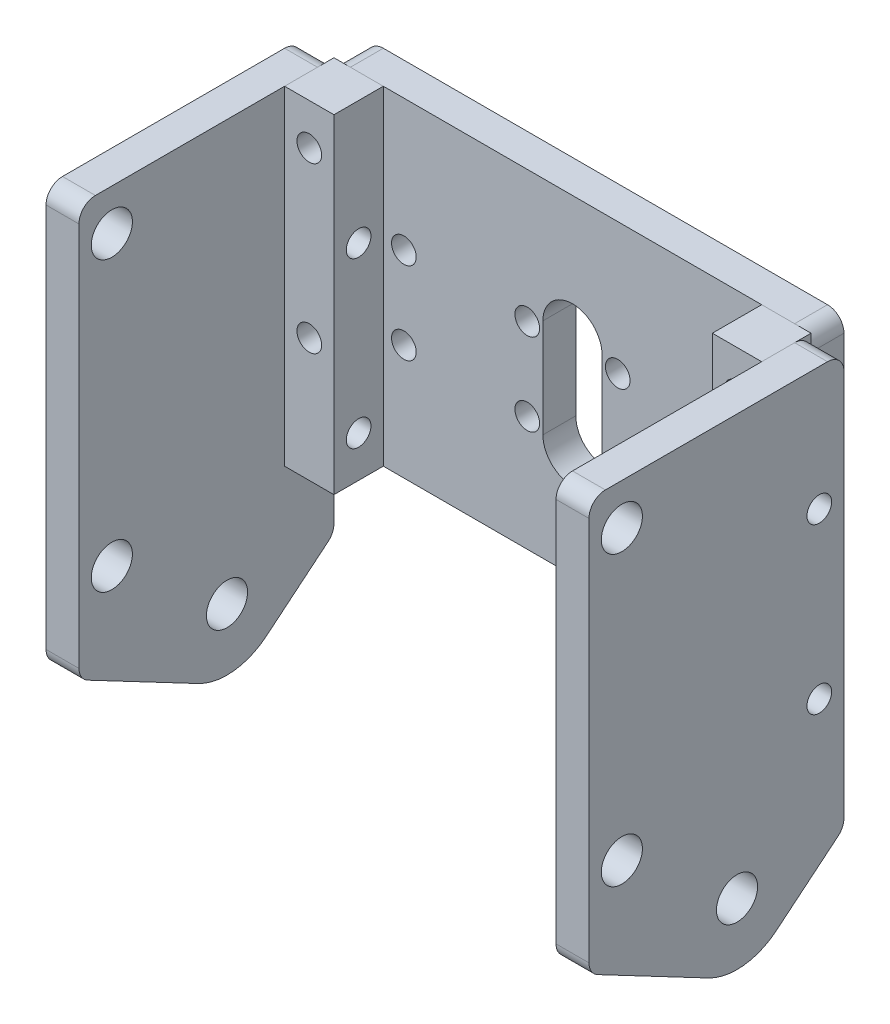
from build123d import *

# Parameters (mm, degrees)
SKETCH_1_W          = 58
SKETCH_1_H          = 40
SKETCH_1_R          = 1.5
EXTRUDE_1_DEPTH     = 4
SKETCH_2_R          = 1.5
CUT_EXTRUDE_1_DEPTH = 4
SKETCH_3_W          = 6
SKETCH_3_H          = 40
SKETCH_3_R          = 1.5
EXTRUDE_2_DEPTH     = 6
EXTRUDE_2_2_DEPTH   = 6
CUT_EXTRUDE_START   = -58
SKETCH_4_R          = 1.5
CUT_EXTRUDE_2_DEPTH = 58
SKETCH_5_W          = 31
SKETCH_5_H          = 40
SKETCH_5_R          = 1.5
EXTRUDE_3_DEPTH     = 4
SKETCH_6_W          = 31
SKETCH_6_H          = 10
EXTRUDE_4_DEPTH     = 4
SKETCH_7_R          = 2.5
CUT_EXTRUDE_3_DEPTH = 4
EXTRUDE_5_DEPTH     = 4
CUT_EXTRUDE_4_DEPTH = 4
FILLET_1_R          = 2
FILLET_2_R          = 2
SKETCH_11_R         = 2.5
CUT_EXTRUDE_5_DEPTH = 4


with BuildPart() as part:
    # 草图1 → 凸台-拉伸1 (new body)
    with BuildSketch(Plane.XY):
        Rectangle(SKETCH_1_W, SKETCH_1_H)
        with Locations((-5.5, 4)):
            Circle(SKETCH_1_R, mode=Mode.SUBTRACT)
        with Locations((-5.5, -6)):
            Circle(SKETCH_1_R, mode=Mode.SUBTRACT)
        with Locations((-20.5, -6)):
            Circle(SKETCH_1_R, mode=Mode.SUBTRACT)
        with Locations((-20.5, 4)):
            Circle(SKETCH_1_R, mode=Mode.SUBTRACT)
        with Locations(Location((20.5, 4, 0), (0, 0, 180))):
            Circle(SKETCH_1_R, mode=Mode.SUBTRACT)
        with Locations(Location((20.5, -6, 0), (0, 0, 180))):
            Circle(SKETCH_1_R, mode=Mode.SUBTRACT)
        with Locations(Location((5.5, -6, 0), (0, 0, 180))):
            Circle(SKETCH_1_R, mode=Mode.SUBTRACT)
        with Locations(Location((5.5, 4, 0), (0, 0, 180))):
            Circle(SKETCH_1_R, mode=Mode.SUBTRACT)
    extrude(amount=EXTRUDE_1_DEPTH)

    # 草图2 → 切除-拉伸1 (cut)
    with BuildSketch(Plane.XY.offset(4)):
        with Locations((26, -5)):
            Circle(SKETCH_2_R)
        with Locations((26, 15)):
            Circle(SKETCH_2_R)
        with Locations((-26, 15)):
            Circle(SKETCH_2_R)
        with Locations((-26, -5)):
            Circle(SKETCH_2_R)
    extrude(amount=-CUT_EXTRUDE_1_DEPTH, mode=Mode.SUBTRACT)

    # 草图9 → 切除-拉伸4 (cut)
    with BuildSketch(Plane(origin=(0, 0, 0), x_dir=(-1, 0, 0), z_dir=(0, 0, -1))):
        with BuildLine():
            Line((-3.6, -7), (-3.6, 5))
            ThreePointArc((-3.6, 5), (0, 8.6), (3.6, 5))
            Line((3.6, 5), (3.6, -7))
            ThreePointArc((3.6, -7), (0, -10.6), (-3.6, -7))
        make_face()
    extrude(amount=-CUT_EXTRUDE_4_DEPTH, mode=Mode.SUBTRACT)

    # 圆角1
    fillet_1_edges = [part.edges().sort_by_distance(p)[0] for p in [
        (29, -20, 2),
        (-29, -20, 2),
        (-29, 20, 2),
        (29, 20, 2),
    ]]
    fillet(fillet_1_edges, radius=FILLET_1_R)


with BuildPart() as body_2:
    # 草图3 → 凸台-拉伸2 (new body)
    with BuildSketch(Plane.XY.offset(4)):
        with Locations((-26, 0)):
            Rectangle(SKETCH_3_W, SKETCH_3_H)
        with Locations((-26, -5)):
            Circle(SKETCH_3_R, mode=Mode.SUBTRACT)
        with Locations((-26, 15)):
            Circle(SKETCH_3_R, mode=Mode.SUBTRACT)
    extrude(amount=EXTRUDE_2_DEPTH)


with BuildPart() as body_3:
    # 草图3 → Extrude 2 2 (new body)
    with BuildSketch(Plane.XY.offset(4)):
        with Locations((26, 0)):
            Rectangle(SKETCH_3_W, SKETCH_3_H)
        with Locations(Location((26, 15, 0), (0, 0, 180))):
            Circle(SKETCH_3_R, mode=Mode.SUBTRACT)
        with Locations(Location((26, -5, 0), (0, 0, 180))):
            Circle(SKETCH_3_R, mode=Mode.SUBTRACT)
    extrude(amount=EXTRUDE_2_2_DEPTH)


with BuildPart() as cut_extrude_2_tool:
    # 草图4 → 切除-拉伸2 (new body)
    with BuildSketch(Plane.ZY.offset(29).offset(CUT_EXTRUDE_START)):
        with Locations(Location((7, -15, 0), (0, 0, 270))):
            Circle(SKETCH_4_R)
        with Locations(Location((7, 5, 0), (0, 0, 270))):
            Circle(SKETCH_4_R)
    extrude(amount=CUT_EXTRUDE_2_DEPTH)


with BuildPart() as body_2_1:
    add(body_2.part)

    # 切除-拉伸2: cut by cut_extrude_2_tool
    add(cut_extrude_2_tool.part, mode=Mode.SUBTRACT)


with BuildPart() as body_3_1:
    add(body_3.part)

    # 切除-拉伸2: cut by cut_extrude_2_tool
    add(cut_extrude_2_tool.part, mode=Mode.SUBTRACT)


with BuildPart() as body_4:
    # 草图5 → 凸台-拉伸3 (new body)
    with BuildSketch(Plane.ZY.offset(29)):
        with Locations((19.5, 0)):
            Rectangle(SKETCH_5_W, SKETCH_5_H)
        with Locations(Location((7, 5, 0), (0, 0, 270))):
            Circle(SKETCH_5_R, mode=Mode.SUBTRACT)
        with Locations(Location((7, -15, 0), (0, 0, 270))):
            Circle(SKETCH_5_R, mode=Mode.SUBTRACT)
    extrude(amount=EXTRUDE_3_DEPTH)

    # 草图6 → 凸台-拉伸4 (add)
    with BuildSketch(Plane.ZY.offset(33)):
        with Locations((19.5, -25)):
            Rectangle(SKETCH_6_W, SKETCH_6_H)
    extrude(amount=-EXTRUDE_4_DEPTH)

    # 草图7 → 切除-拉伸3 (cut)
    with BuildSketch(Plane.ZY.offset(33)):
        with Locations(Location((31, 15, 0), (0, 0, 270))):
            Circle(SKETCH_7_R)
        with Locations(Location((31, -20, 0), (0, 0, 270))):
            Circle(SKETCH_7_R)
    extrude(amount=-CUT_EXTRUDE_3_DEPTH, mode=Mode.SUBTRACT)

    # 草图8 → 凸台-拉伸5 (add)
    with BuildSketch(Plane.ZY.offset(33)):
        with BuildLine():
            Line((20.493698376, -37.636570775), (35, -30))
            Line((35, -30), (19.291287847, -30))
            ThreePointArc((19.291287847, -30), (17, -33.5), (14.708712153, -30))
            Line((14.708712153, -30), (4, -30))
            Line((4, -30), (12.227998625, -36.786017877))
            ThreePointArc((12.227998625, -36.786017877), (16.232292571, -38.460604889), (20.493698376, -37.636570775))
        make_face()
    extrude(amount=-EXTRUDE_5_DEPTH)

    # 圆角2
    fillet_2_edges = [body_4.edges().sort_by_distance(p)[0] for p in [
        (-31, -30, 4),
        (-31, -30, 35),
        (-31, 20, 4),
        (-31, 20, 35),
    ]]
    fillet(fillet_2_edges, radius=FILLET_2_R)

    # 草图11 → 切除-拉伸5 (cut)
    with BuildSketch(Plane.ZY.offset(33)):
        with Locations(Location((17, -31, 0), (0, 0, 270))):
            Circle(SKETCH_11_R)
    extrude(amount=-CUT_EXTRUDE_5_DEPTH, mode=Mode.SUBTRACT)


with BuildPart() as body_5:
    # 镜向1: mirrored copy
    add(body_4.part.mirror(Plane(origin=(0, 0, 0), x_dir=(0, 0, 1), z_dir=(1, 0, 0))))


solid = Compound([part.part, body_2_1.part, body_3_1.part, body_4.part, body_5.part])
